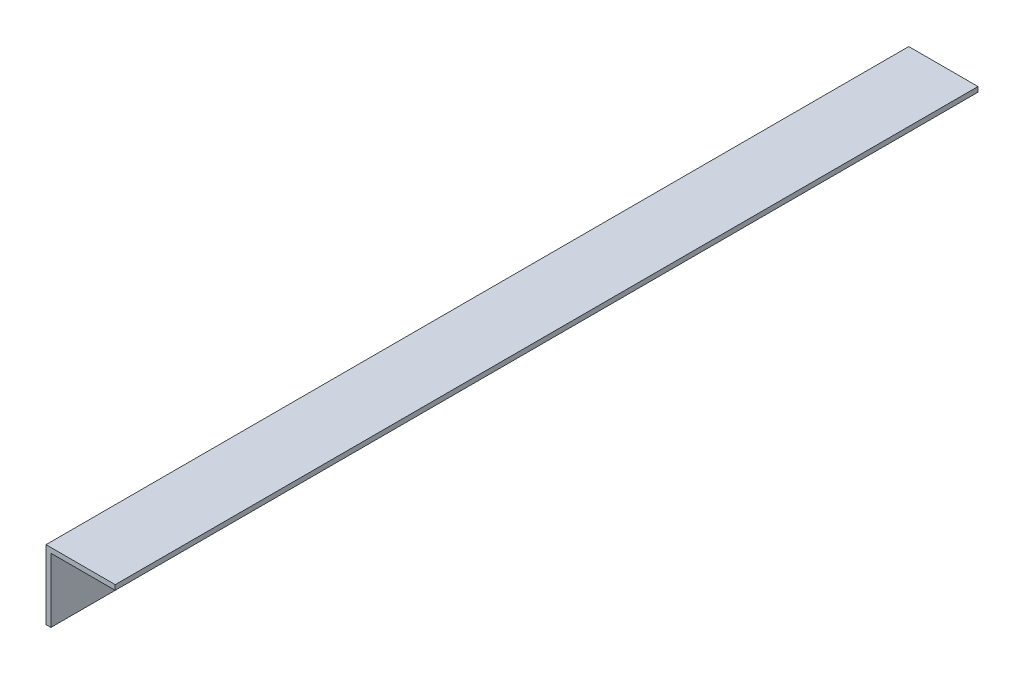
from build123d import *

# Parameters (mm, degrees)
SALIENTE_EXTRUIR1_DEPTH = 1107.6


with BuildPart() as part:
    # Croquis1 → Saliente-Extruir1 (new body)
    with BuildSketch(Plane.XY):
        Polygon((0, 0), (88.9, 0), (88.9, -6.35), (6.35, -6.35), (6.35, -88.9), (0, -88.9), align=None)
    extrude(amount=SALIENTE_EXTRUIR1_DEPTH)


solid = part.part
